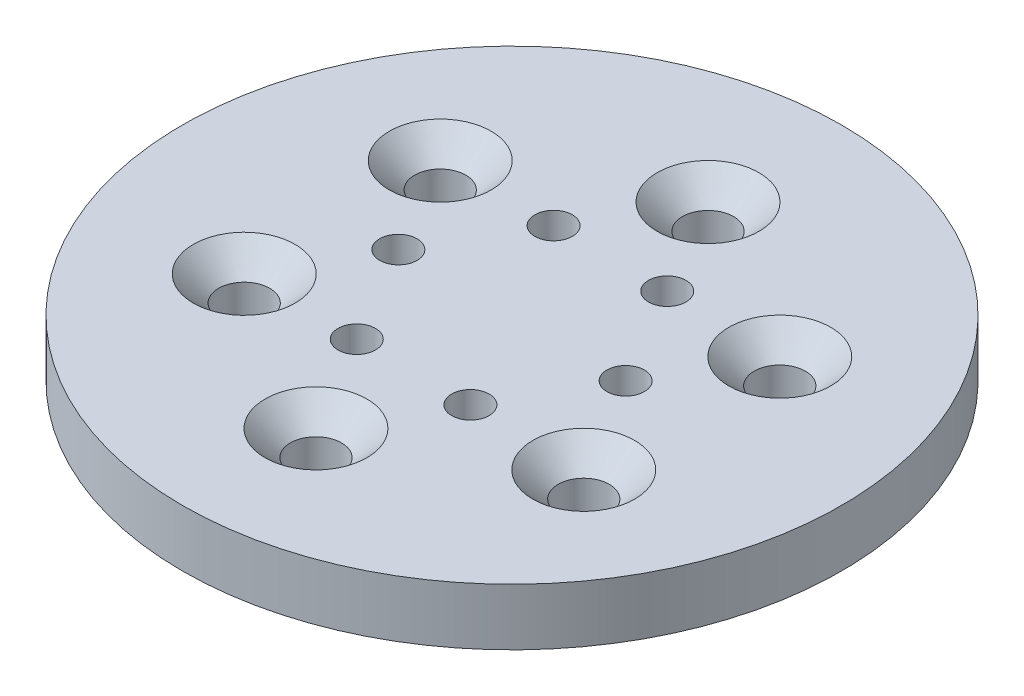
from build123d import *

# Parameters (mm, degrees)
SKIZZE1_R                                            = 29
AUFSATZ_LINEAR_AUSTRAGEN1_DEPTH                      = 5
FORMSENKUNG_F_R_M4_SENKSCHRAUBE_MIT_INNE_D           = 4.5
FORMSENKUNG_F_R_M4_SENKSCHRAUBE_MIT_INNE_CSINK_D     = 8.96
FORMSENKUNG_F_R_M4_SENKSCHRAUBE_MIT_INNE_CSINK_ANGLE = 90
M4_GEWINDEBOHRUNG1_D                                 = 3.3


with BuildPart() as part:
    # Skizze1 → Aufsatz-Linear austragen1 (new body)
    with BuildSketch(Plane(origin=(0, 0, 0), x_dir=(1, 0, 0), z_dir=(0, 1, 0))):
        with Locations(Location((0, 0, 0), (0, 0, 270))):
            Circle(SKIZZE1_R)
    extrude(amount=AUFSATZ_LINEAR_AUSTRAGEN1_DEPTH)

    # Formsenkung für M4 Senkschraube mit Innensechskant1 (through all)
    with Locations(Plane(origin=(0, 5, 0), x_dir=(1, 0, 0), z_dir=(0, 1, 0))):
        with Locations((-14.938938215, 8.625), (0, 17.25), (14.938938215, 8.625), (14.938938215, -8.625), (0, -17.25), (-14.938938215, -8.625)):
            CounterSinkHole(FORMSENKUNG_F_R_M4_SENKSCHRAUBE_MIT_INNE_D / 2, FORMSENKUNG_F_R_M4_SENKSCHRAUBE_MIT_INNE_CSINK_D / 2, counter_sink_angle=FORMSENKUNG_F_R_M4_SENKSCHRAUBE_MIT_INNE_CSINK_ANGLE)

    # M4 Gewindebohrung1 (through all)
    with Locations(Plane(origin=(0, 5, 0), x_dir=(1, 0, 0), z_dir=(0, 1, 0))):
        with Locations((-10, 0), (-5, 8.660254038), (5, 8.660254038), (10, 0), (5, -8.660254038), (-5, -8.660254038)):
            Hole(M4_GEWINDEBOHRUNG1_D / 2)


solid = part.part
